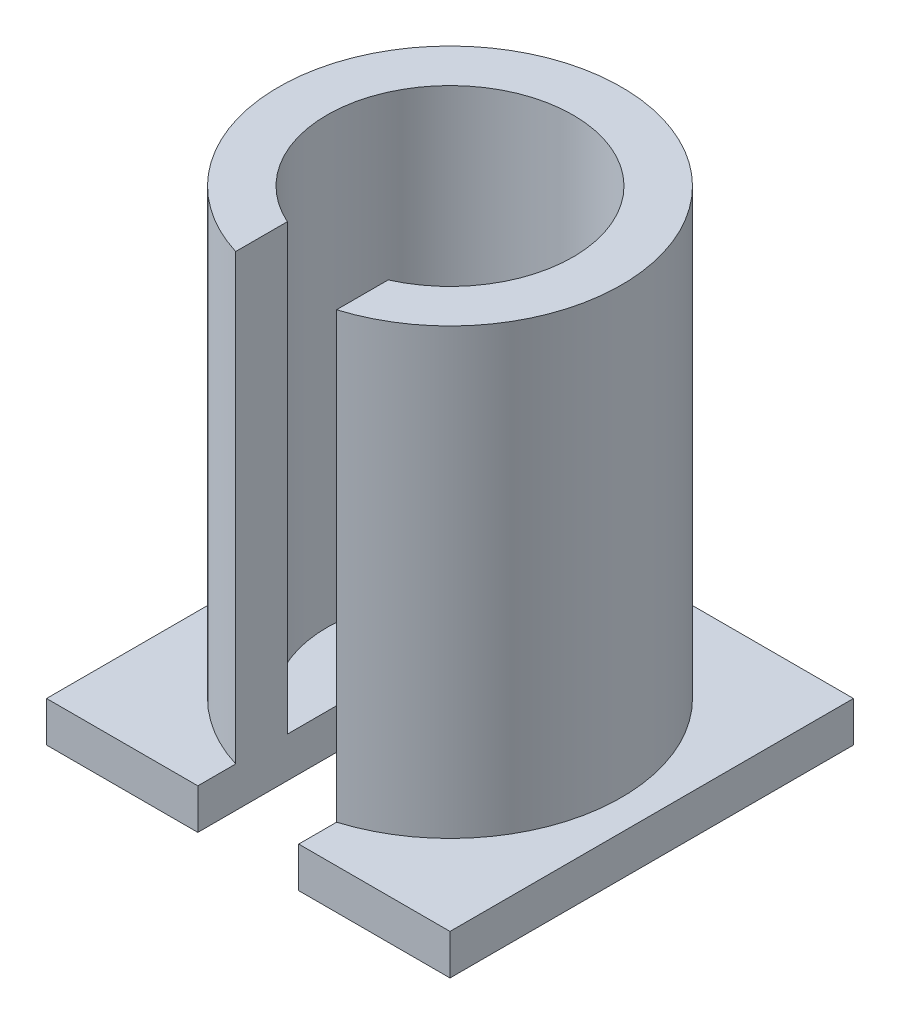
from build123d import *

# Parameters (mm, degrees)
SKETCH1_R           = 4.25
SKETCH1_R_2         = 3.05
BOSS_EXTRUDE1_DEPTH = 12
SKETCH2_R           = 3.05
SKETCH2_R_2         = 1.25
BOSS_EXTRUDE2_DEPTH = 1
CUT_EXTRUDE1_DEPTH  = 15
BOSS_EXTRUDE3_DEPTH = 1


with BuildPart() as part:
    # Sketch1 → Boss-Extrude1 (new body)
    with BuildSketch(Plane(origin=(0, 0, 0), x_dir=(1, 0, 0), z_dir=(0, 1, 0))):
        with Locations(Location((0, 0, 0), (0, 0, 270))):
            Circle(SKETCH1_R)
        with Locations(Location((0, 0, 0), (0, 0, 270))):
            Circle(SKETCH1_R_2, mode=Mode.SUBTRACT)
    extrude(amount=BOSS_EXTRUDE1_DEPTH)

    # Sketch2 → Boss-Extrude2 (add)
    with BuildSketch(Plane(origin=(0, 0, 0), x_dir=(1, 0, 0), z_dir=(0, 1, 0))):
        with Locations(Location((0, 0, 0), (0, 0, 270))):
            Circle(SKETCH2_R)
        with Locations(Location((0, 0, 0), (0, 0, 270))):
            Circle(SKETCH2_R_2, mode=Mode.SUBTRACT)
    extrude(amount=BOSS_EXTRUDE2_DEPTH)

    # Sketch3 → Cut-Extrude1 (cut)
    with BuildSketch(Plane(origin=(0, 0, 0), x_dir=(1, 0, 0), z_dir=(0, 1, 0))):
        with BuildLine():
            ThreePointArc((1.25, 0), (0, -1.25), (-1.25, 0))
            Line((-1.25, 0), (-1.25, -5.072282681))
            Line((-1.25, -5.072282681), (1.25, -5.072282681))
            Line((1.25, -5.072282681), (1.25, 0))
        make_face()
    extrude(amount=CUT_EXTRUDE1_DEPTH, mode=Mode.SUBTRACT)

    # Sketch4 → Boss-Extrude3 (add)
    with BuildSketch(Plane(origin=(0, 0, 0), x_dir=(1, 0, 0), z_dir=(0, 1, 0))):
        with BuildLine():
            Line((-1.25, -5), (-1.25, 0))
            ThreePointArc((-1.25, 0), (0, 1.25), (1.25, 0))
            Line((1.25, 0), (1.25, -5))
            Line((1.25, -5), (5, -5))
            Line((5, -5), (5, 5))
            Line((5, 5), (-5, 5))
            Line((-5, 5), (-5, -5))
            Line((-5, -5), (-1.25, -5))
        make_face()
    extrude(amount=BOSS_EXTRUDE3_DEPTH)


solid = part.part
